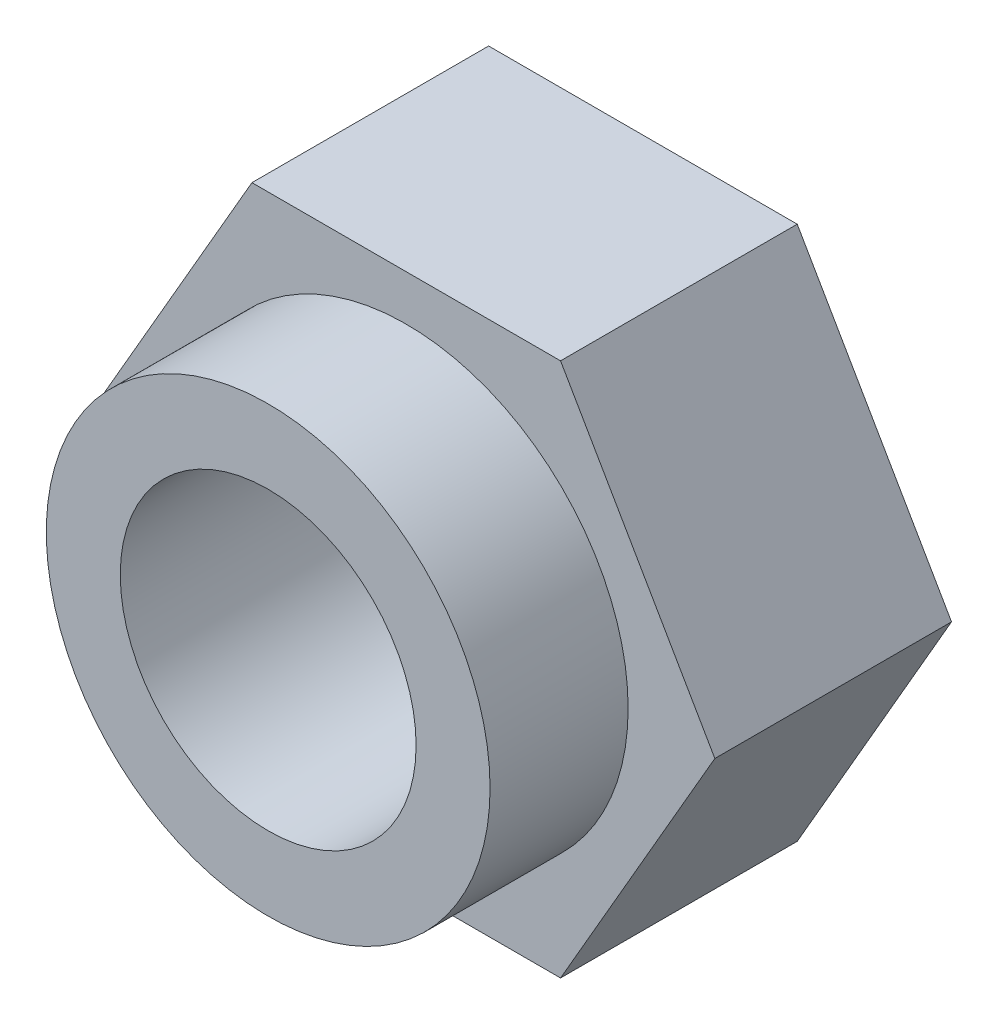
from build123d import *

# Parameters (mm, degrees)
EXTRUDE_1_DEPTH     = 2.4
SKETCH_2_R          = 2.25
EXTRUDE_2_DEPTH     = 1.4
SKETCH_3_R          = 1.5
CUT_EXTRUDE_1_DEPTH = 4.4


with BuildPart() as part:
    # 草图1 → 凸台-拉伸1 (new body)
    with BuildSketch(Plane.XY):
        Polygon((3.129238459, 0), (1.56461923, 2.71), (-1.56461923, 2.71), (-3.129238459, 0), (-1.56461923, -2.71), (1.56461923, -2.71), align=None)
    extrude(amount=EXTRUDE_1_DEPTH)

    # 草图2 → 凸台-拉伸2 (add)
    with BuildSketch(Plane.XY.offset(2.4)):
        Circle(SKETCH_2_R)
    extrude(amount=EXTRUDE_2_DEPTH)

    # 草图3 → 切除-拉伸1 (cut)
    with BuildSketch(Plane.XY.offset(3.8)):
        Circle(SKETCH_3_R)
    extrude(amount=-CUT_EXTRUDE_1_DEPTH, mode=Mode.SUBTRACT)


solid = part.part
